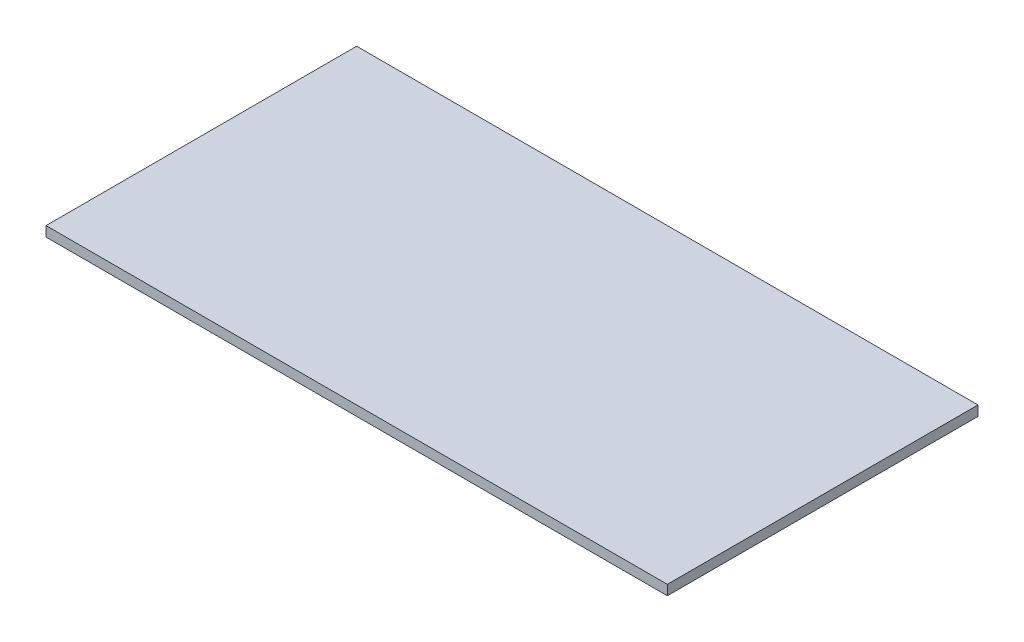
from build123d import *

# Parameters (mm, degrees)
SKETCH1_W           = 100
SKETCH1_H           = 50
BOSS_EXTRUDE1_DEPTH = 1.6


with BuildPart() as part:
    # Sketch1 → Boss-Extrude1 (new body)
    with BuildSketch(Plane(origin=(0, 0, 0), x_dir=(1, 0, 0), z_dir=(0, 1, 0))):
        with Locations((50, 25)):
            Rectangle(SKETCH1_W, SKETCH1_H)
    extrude(amount=BOSS_EXTRUDE1_DEPTH)


solid = part.part
